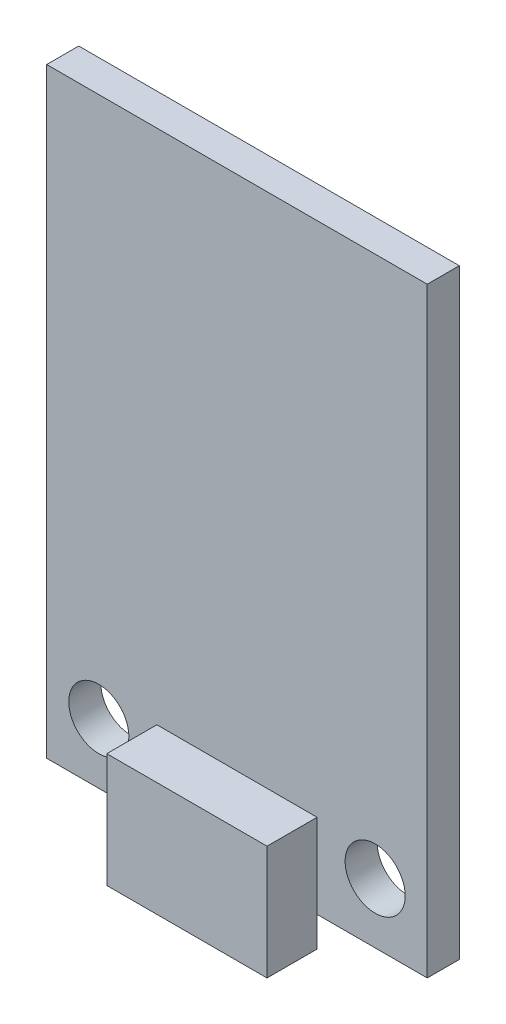
from build123d import *

# Parameters (mm, degrees)
ESQUISSE1_W             = 19
ESQUISSE1_H             = 30
BOSS_EXTRU_1_DEPTH      = 1.6
ESQUISSE2_W             = 8
ESQUISSE2_H             = 5.7
BOSS_EXTRU_2_DEPTH      = 2.5
ENL_V_MAT_EXTRU_1_REACH = 37.598
ESQUISSE3_R             = 1.5


with BuildPart() as part:
    # Esquisse1 → Boss.-Extru.1 (new body)
    with BuildSketch(Plane.XY):
        with Locations((9.5, 15)):
            Rectangle(ESQUISSE1_W, ESQUISSE1_H)
    extrude(amount=BOSS_EXTRU_1_DEPTH)

    # Esquisse2 → Boss.-Extru.2 (add)
    with BuildSketch(Plane.XY.offset(1.6)):
        with Locations((9.5, 1.35)):
            Rectangle(ESQUISSE2_W, ESQUISSE2_H)
    extrude(amount=BOSS_EXTRU_2_DEPTH)

    # Esquisse3 → Enlèv. mat.-Extru.1 (cut, up to next)
    with BuildSketch(Plane.XY.offset(1.6), mode=Mode.PRIVATE) as enl_v_mat_extru_1_sk1:
        with Locations((16.4, 3)):
            Circle(ESQUISSE3_R)
    enl_v_mat_extru_1_tool1 = extrude(enl_v_mat_extru_1_sk1.sketch, amount=-ENL_V_MAT_EXTRU_1_REACH, mode=Mode.PRIVATE) & part.part
    # Esquisse3 → Enlèv. mat.-Extru.1 (cut, up to next)
    with BuildSketch(Plane.XY.offset(1.6), mode=Mode.PRIVATE) as enl_v_mat_extru_1_sk2:
        with Locations(Location((2.6, 3, 0), (0, 0, 180))):
            Circle(ESQUISSE3_R)
    enl_v_mat_extru_1_tool2 = extrude(enl_v_mat_extru_1_sk2.sketch, amount=-ENL_V_MAT_EXTRU_1_REACH, mode=Mode.PRIVATE) & part.part
    add(enl_v_mat_extru_1_tool1.solids().sort_by_distance((16.4, 3, 1.6))[0], mode=Mode.SUBTRACT)
    add(enl_v_mat_extru_1_tool2.solids().sort_by_distance((2.6, 3, 1.6))[0], mode=Mode.SUBTRACT)


solid = part.part
